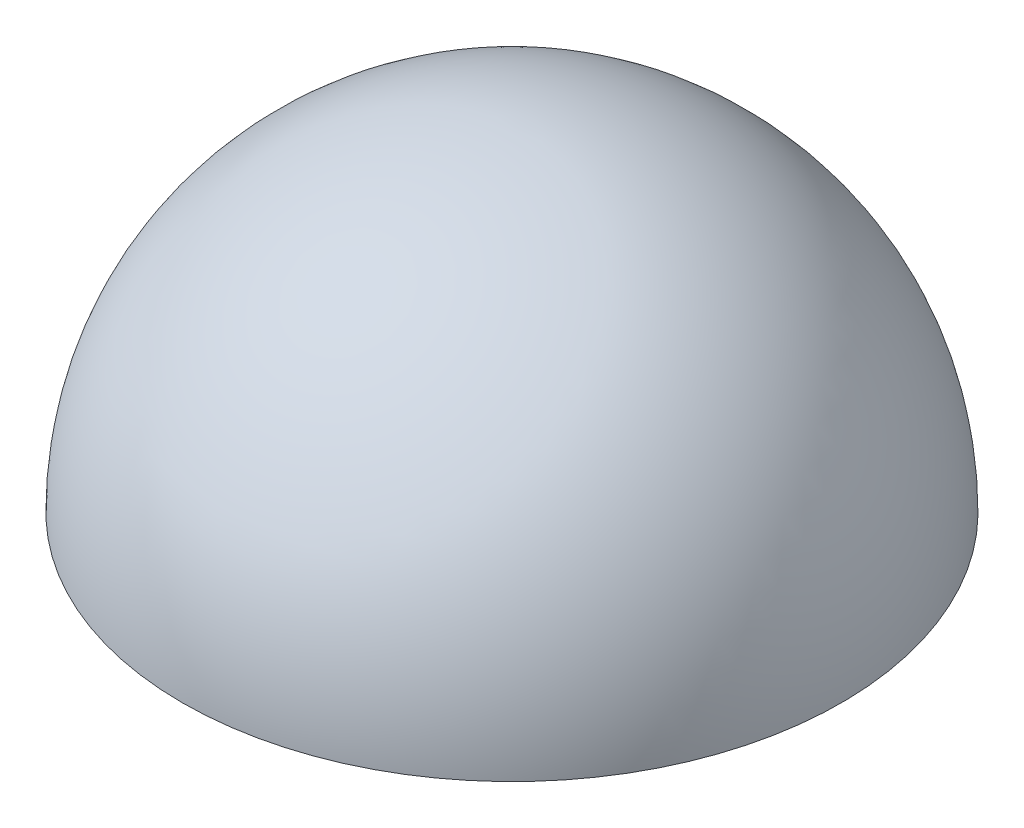
from build123d import *

# Parameters (mm, degrees)
REVOLVE2_ANGLE = 180


with BuildPart() as part:
    # Sketch1 → Revolve2 (revolve)
    with BuildSketch(Plane(origin=(0, 0, 0), x_dir=(1, 0, 0), z_dir=(0, 1, 0))):
        with BuildLine():
            Line((0, 19.05), (0, -19.05))
            ThreePointArc((0, -19.05), (19.05, 0), (0, 19.05))
        make_face()
    revolve(axis=Axis((0, 0, -19.05), (0, 0, 1)), revolution_arc=REVOLVE2_ANGLE)


solid = part.part
